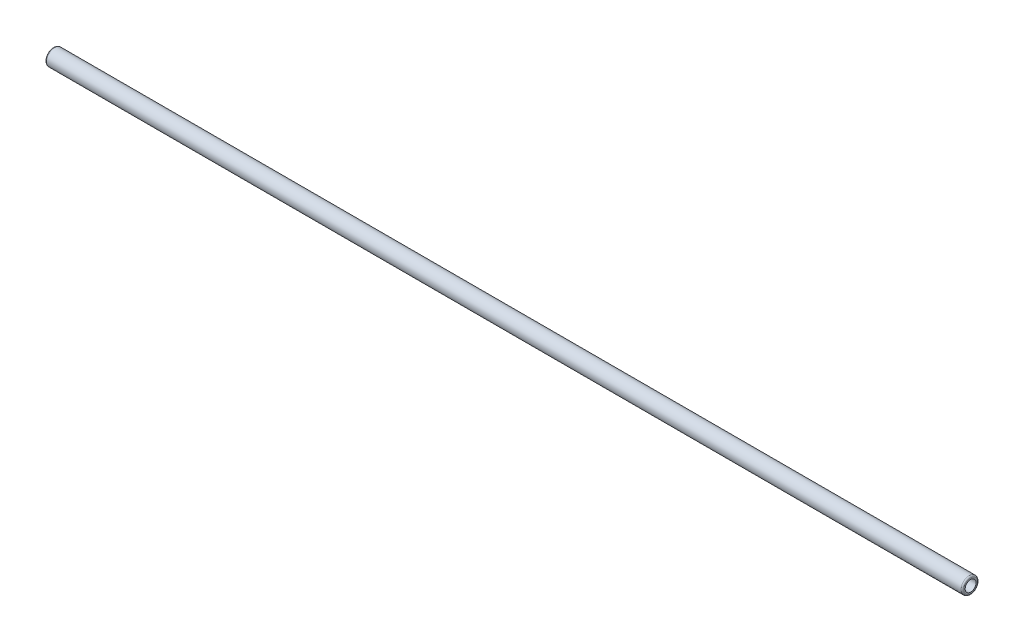
from build123d import *

# Parameters (mm, degrees)
SKETCH_1_R      = 3
SKETCH_1_R_2    = 2
EXTRUDE_1_DEPTH = 168
FILLET_1_R      = 0.5


with BuildPart() as part:
    # Эскиз1 → Бобышка-Вытянуть1 (new, symmetric)
    with BuildSketch(Plane(origin=(0, 0, 0), x_dir=(0, 0, -1), z_dir=(1, 0, 0))):
        with Locations(Location((0, 0, 0), (0, 0, 180))):
            Circle(SKETCH_1_R)
        with Locations(Location((0, 0, 0), (0, 0, 180))):
            Circle(SKETCH_1_R_2, mode=Mode.SUBTRACT)
    extrude(amount=EXTRUDE_1_DEPTH, both=True)

    # Скругление1
    fillet_1_edges = [part.edges().sort_by_distance(p)[0] for p in [
        (-168, 0, -3),
        (168, 0, -3),
    ]]
    fillet(fillet_1_edges, radius=FILLET_1_R)


solid = part.part
